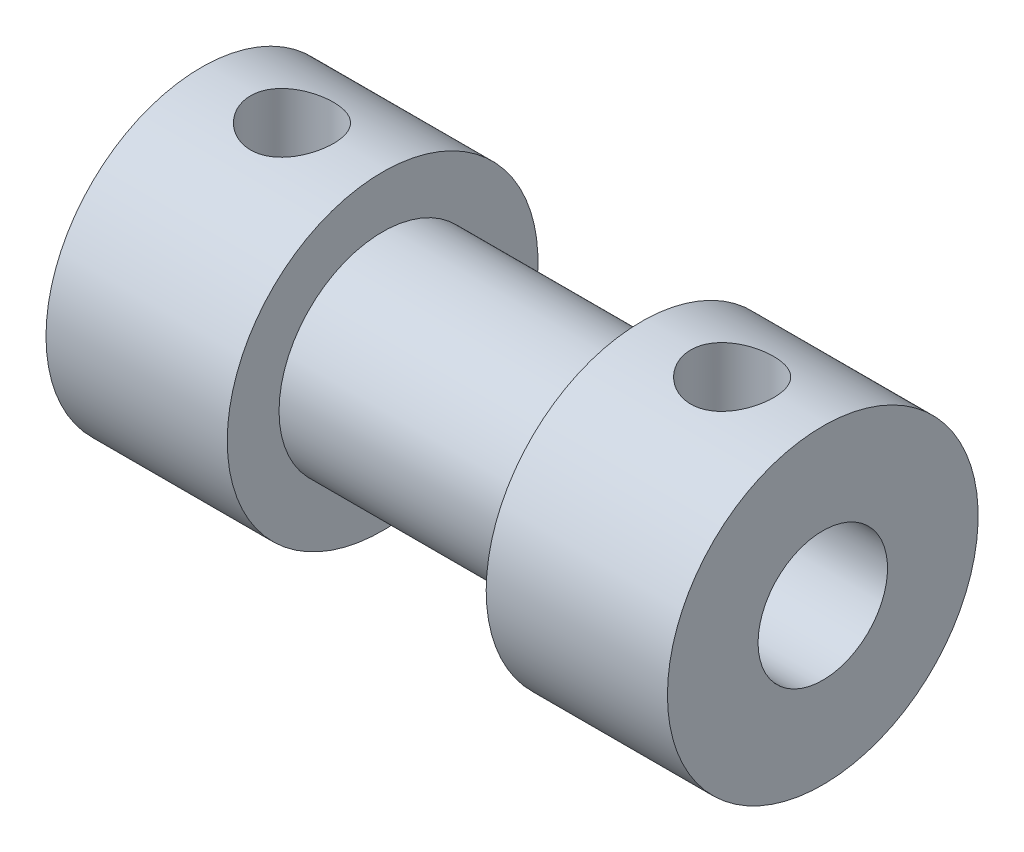
from build123d import *

# Parameters (mm, degrees)
SKETCH2_R          = 1.6
CUT_EXTRUDE1_DEPTH = 10


with BuildPart() as part:
    # Sketch1 → Revolve1 (revolve)
    with BuildSketch(Plane.XY, mode=Mode.PRIVATE) as revolve1_sk:
        Polygon((0, -2.5), (0, -6), (7, -6), (7, -4), (17, -4), (17, -6), (24, -6), (24, -2.5), align=None)
    revolve(revolve1_sk.sketch.rotate(Axis((0, 0, 0), (1, 0, 0)), 270), axis=Axis((0, 0, 0), (1, 0, 0)))

    # Sketch2 → Cut-Extrude1 (cut)
    with BuildSketch(Plane(origin=(0, 0, 0), x_dir=(1, 0, 0), z_dir=(0, 1, 0))):
        with Locations(Location((3.5, 0, 0), (0, 0, 90))):
            Circle(SKETCH2_R)
        with Locations(Location((20.5, 0, 0), (0, 0, 90))):
            Circle(SKETCH2_R)
    extrude(amount=CUT_EXTRUDE1_DEPTH, mode=Mode.SUBTRACT)


solid = part.part
